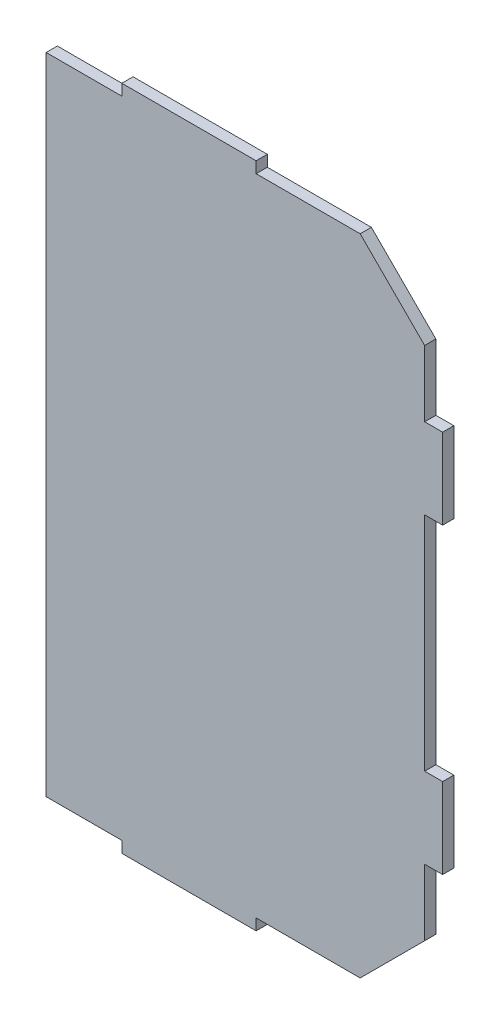
from build123d import *

# Parameters (mm, degrees)
BOSS_EXTRUDE1_DEPTH = 10.6


with BuildPart() as part:
    # Sketch1 → Boss-Extrude1 (new body)
    with BuildSketch(Plane.XY):
        Polygon((-398.83809218, -315.4), (-271.83809218, -315.4), (-271.83809218, -304.8), (-173.430774761, -304.8), (-112.431652929, -243.800878167), (-112.431652929, -181.104658845), (-95.431652929, -181.104658845), (-95.431652929, -104.904658845), (-112.431652929, -104.904658845), (-112.431652929, 105.095341155), (-95.431652929, 105.095341155), (-95.431652929, 181.295341155), (-112.431652929, 181.295341155), (-112.431652929, 243.800878167), (-173.430774761, 304.8), (-271.83809218, 304.8), (-271.83809218, 315.4), (-398.83809218, 315.4), (-398.83809218, 304.8), (-470.431652929, 304.8), (-470.431652929, -304.8), (-398.83809218, -304.8), align=None)
    extrude(amount=BOSS_EXTRUDE1_DEPTH)


solid = part.part
